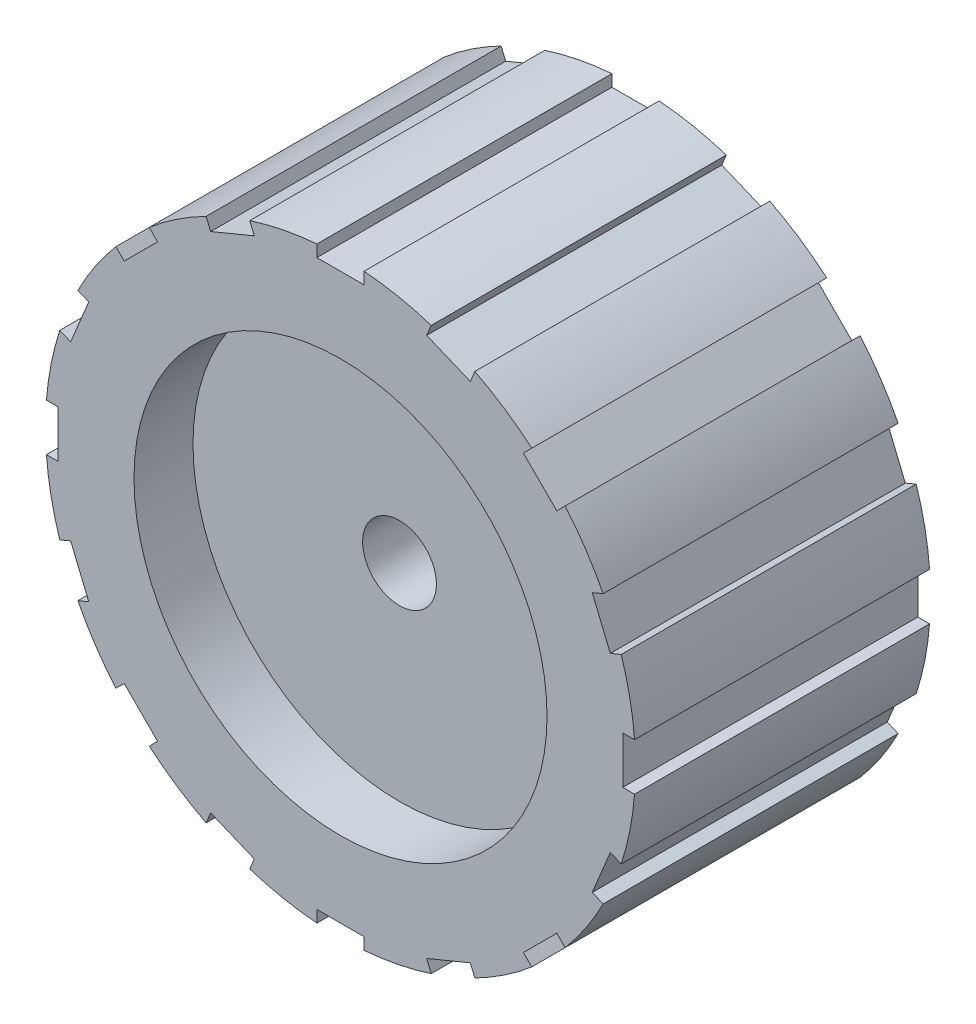
from build123d import *

# Parameters (mm, degrees)
SKETCH1_R           = 17.78
BOSS_EXTRUDE2_DEPTH = 25.4
SKETCH1_3_R         = 17.78
SKETCH1_3_R_2       = 3.175
BOSS_EXTRUDE3_DEPTH = 20.32
SKETCH1_4_R         = 17.78
SKETCH1_4_R_2       = 3.175
CUT_EXTRUDE1_DEPTH  = 5.08


with BuildPart() as part:
    # Sketch1 → Boss-Extrude2 (new body)
    with BuildSketch(Plane.XY):
        with BuildLine():
            ThreePointArc((16.46610537, 19.339787329), (14.111483919, 21.119328152), (11.566327956, 22.613713928))
            Line((11.566327956, 22.613713928), (11.177521588, 21.675052323))
            Line((11.177521588, 21.675052323), (7.422875168, 23.230277792))
            Line((7.422875168, 23.230277792), (7.811681536, 24.168939397))
            ThreePointArc((7.811681536, 24.168939397), (4.955294179, 24.911946122), (2.032, 25.318589534))
            Line((2.032, 25.318589534), (2.032, 24.302589534))
            Line((2.032, 24.302589534), (-2.032, 24.302589534))
            Line((-2.032, 24.302589534), (-2.032, 25.318589534))
            ThreePointArc((-2.032, 25.318589534), (-4.955294179, 24.911946122), (-7.811681536, 24.168939397))
            Line((-7.811681536, 24.168939397), (-7.422875168, 23.230277792))
            Line((-7.422875168, 23.230277792), (-11.177521588, 21.675052323))
            Line((-11.177521588, 21.675052323), (-11.566327956, 22.613713928))
            ThreePointArc((-11.566327956, 22.613713928), (-14.111483919, 21.119328152), (-16.46610537, 19.339787329))
            Line((-16.46610537, 19.339787329), (-15.747684881, 18.621366839))
            Line((-15.747684881, 18.621366839), (-18.621366839, 15.747684881))
            Line((-18.621366839, 15.747684881), (-19.339787329, 16.46610537))
            ThreePointArc((-19.339787329, 16.46610537), (-21.119328152, 14.111483919), (-22.613713928, 11.566327956))
            Line((-22.613713928, 11.566327956), (-21.675052323, 11.177521588))
            Line((-21.675052323, 11.177521588), (-23.230277792, 7.422875168))
            Line((-23.230277792, 7.422875168), (-24.168939397, 7.811681536))
            ThreePointArc((-24.168939397, 7.811681536), (-24.911946122, 4.955294179), (-25.318589534, 2.032))
            Line((-25.318589534, 2.032), (-24.302589534, 2.032))
            Line((-24.302589534, 2.032), (-24.302589534, -2.032))
            Line((-24.302589534, -2.032), (-25.318589534, -2.032))
            ThreePointArc((-25.318589534, -2.032), (-24.911946122, -4.955294179), (-24.168939397, -7.811681536))
            Line((-24.168939397, -7.811681536), (-23.230277792, -7.422875168))
            Line((-23.230277792, -7.422875168), (-21.675052323, -11.177521588))
            Line((-21.675052323, -11.177521588), (-22.613713928, -11.566327956))
            ThreePointArc((-22.613713928, -11.566327956), (-21.119328152, -14.111483919), (-19.339787329, -16.46610537))
            Line((-19.339787329, -16.46610537), (-18.621366839, -15.747684881))
            Line((-18.621366839, -15.747684881), (-15.747684881, -18.621366839))
            Line((-15.747684881, -18.621366839), (-16.46610537, -19.339787329))
            ThreePointArc((-16.46610537, -19.339787329), (-14.111483919, -21.119328152), (-11.566327956, -22.613713928))
            Line((-11.566327956, -22.613713928), (-11.177521588, -21.675052323))
            Line((-11.177521588, -21.675052323), (-7.422875168, -23.230277792))
            Line((-7.422875168, -23.230277792), (-7.811681536, -24.168939397))
            ThreePointArc((-7.811681536, -24.168939397), (-4.955294179, -24.911946122), (-2.032, -25.318589534))
            Line((-2.032, -25.318589534), (-2.032, -24.302589534))
            Line((-2.032, -24.302589534), (2.032, -24.302589534))
            Line((2.032, -24.302589534), (2.032, -25.318589534))
            ThreePointArc((2.032, -25.318589534), (4.955294179, -24.911946122), (7.811681536, -24.168939397))
            Line((7.811681536, -24.168939397), (7.422875168, -23.230277792))
            Line((7.422875168, -23.230277792), (11.177521588, -21.675052323))
            Line((11.177521588, -21.675052323), (11.566327956, -22.613713928))
            ThreePointArc((11.566327956, -22.613713928), (14.111483919, -21.119328152), (16.46610537, -19.339787329))
            Line((16.46610537, -19.339787329), (15.747684881, -18.621366839))
            Line((15.747684881, -18.621366839), (18.621366839, -15.747684881))
            Line((18.621366839, -15.747684881), (19.339787329, -16.46610537))
            ThreePointArc((19.339787329, -16.46610537), (21.119328152, -14.111483919), (22.613713928, -11.566327956))
            Line((22.613713928, -11.566327956), (21.675052323, -11.177521588))
            Line((21.675052323, -11.177521588), (23.230277792, -7.422875168))
            Line((23.230277792, -7.422875168), (24.168939397, -7.811681536))
            ThreePointArc((24.168939397, -7.811681536), (24.911946122, -4.955294179), (25.318589534, -2.032))
            Line((25.318589534, -2.032), (24.302589534, -2.032))
            Line((24.302589534, -2.032), (24.302589534, 2.032))
            Line((24.302589534, 2.032), (25.318589534, 2.032))
            ThreePointArc((25.318589534, 2.032), (24.911946122, 4.955294179), (24.168939397, 7.811681536))
            Line((24.168939397, 7.811681536), (23.230277792, 7.422875168))
            Line((23.230277792, 7.422875168), (21.675052323, 11.177521588))
            Line((21.675052323, 11.177521588), (22.613713928, 11.566327956))
            ThreePointArc((22.613713928, 11.566327956), (21.119328152, 14.111483919), (19.339787329, 16.46610537))
            Line((19.339787329, 16.46610537), (18.621366839, 15.747684881))
            Line((18.621366839, 15.747684881), (15.747684881, 18.621366839))
            Line((15.747684881, 18.621366839), (16.46610537, 19.339787329))
        make_face()
        Circle(SKETCH1_R, mode=Mode.SUBTRACT)
    extrude(amount=BOSS_EXTRUDE2_DEPTH)

    # Sketch1<3> → Boss-Extrude3 (add)
    with BuildSketch(Plane.XY):
        Circle(SKETCH1_3_R)
        Circle(SKETCH1_3_R_2, mode=Mode.SUBTRACT)
    extrude(amount=BOSS_EXTRUDE3_DEPTH)

    # Sketch1<4> → Cut-Extrude1 (cut)
    with BuildSketch(Plane.XY):
        Circle(SKETCH1_4_R)
        Circle(SKETCH1_4_R_2, mode=Mode.SUBTRACT)
    extrude(amount=CUT_EXTRUDE1_DEPTH, mode=Mode.SUBTRACT)


solid = part.part
